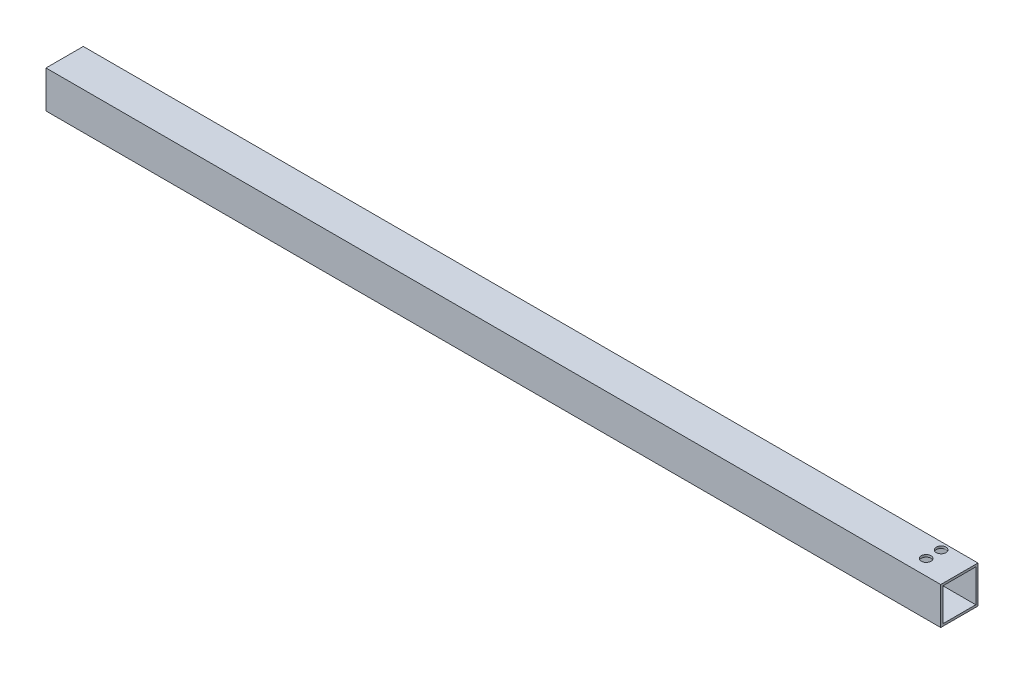
from build123d import *

# Parameters (mm, degrees)
SKETCH1_W           = 50
SKETCH1_H           = 50
SKETCH1_W_2         = 44
SKETCH1_H_2         = 44
BOSS_EXTRUDE1_DEPTH = 1200
CUT_EXTRUDE1_REACH  = 1203.301
SKETCH2_R           = 19
CUT_EXTRUDE2_REACH  = 1203.301
SKETCH3_R           = 6.5
CIRPATTERN1_COUNT   = 2


with BuildPart() as part:
    # Sketch1 → Boss-Extrude1 (new body)
    with BuildSketch(Plane(origin=(0, 0, 0), x_dir=(0, 0, -1), z_dir=(1, 0, 0))):
        Rectangle(SKETCH1_W, SKETCH1_H)
        Rectangle(SKETCH1_W_2, SKETCH1_H_2, mode=Mode.SUBTRACT)
    extrude(amount=BOSS_EXTRUDE1_DEPTH)

    # Sketch2 → Cut-Extrude1 (cut, up to next)
    with BuildSketch(Plane(origin=(0, 0, -25), x_dir=(-1, 0, 0), z_dir=(0, 0, -1)), mode=Mode.PRIVATE) as cut_extrude1_sk1:
        with Locations(Location((-950, 0, 0), (0, 0, 90))):
            Circle(SKETCH2_R)
    cut_extrude1_tool1 = extrude(cut_extrude1_sk1.sketch, amount=-CUT_EXTRUDE1_REACH, mode=Mode.PRIVATE) & part.part
    add(cut_extrude1_tool1.solids().sort_by_distance((950, 0, -25))[0], mode=Mode.SUBTRACT)

    # Sketch3 → Cut-Extrude2 (cut, up to next)
    with BuildSketch(Plane(origin=(0, 25, 0), x_dir=(1, 0, 0), z_dir=(0, 1, 0)), mode=Mode.PRIVATE) as cut_extrude2_sk1:
        with Locations(Location((1160, -4.5, 0), (0, 0, 270))):
            Circle(SKETCH3_R)
    cut_extrude2_tool1 = extrude(cut_extrude2_sk1.sketch, amount=-CUT_EXTRUDE2_REACH, mode=Mode.PRIVATE) & part.part
    # Sketch3 → Cut-Extrude2 (cut, up to next)
    with BuildSketch(Plane(origin=(0, 25, 0), x_dir=(1, 0, 0), z_dir=(0, 1, 0)), mode=Mode.PRIVATE) as cut_extrude2_sk2:
        with Locations(Location((1160, 15.5, 0), (0, 0, 270))):
            Circle(SKETCH3_R)
    cut_extrude2_tool2 = extrude(cut_extrude2_sk2.sketch, amount=-CUT_EXTRUDE2_REACH, mode=Mode.PRIVATE) & part.part
    cut_extrude2_1 = cut_extrude2_tool1.solids().sort_by_distance((1160, 25, 4.5))[0]
    add(cut_extrude2_1, mode=Mode.SUBTRACT)
    cut_extrude2_2 = cut_extrude2_tool2.solids().sort_by_distance((1160, 25, -15.5))[0]
    add(cut_extrude2_2, mode=Mode.SUBTRACT)
    cut_extrude2 = cut_extrude2_1 + cut_extrude2_2  # Cut-Extrude2 as one shape, for the pattern or mirror that repeats it

    # CirPattern1: Cut-Extrude2 ×2 about axis
    cirpattern1_axis = Axis((950, 0, 25.001), (0, 0, -1))
    for i in range(1, CIRPATTERN1_COUNT):
        add(cut_extrude2.rotate(cirpattern1_axis, i * 360 / CIRPATTERN1_COUNT), mode=Mode.SUBTRACT)


solid = part.part
